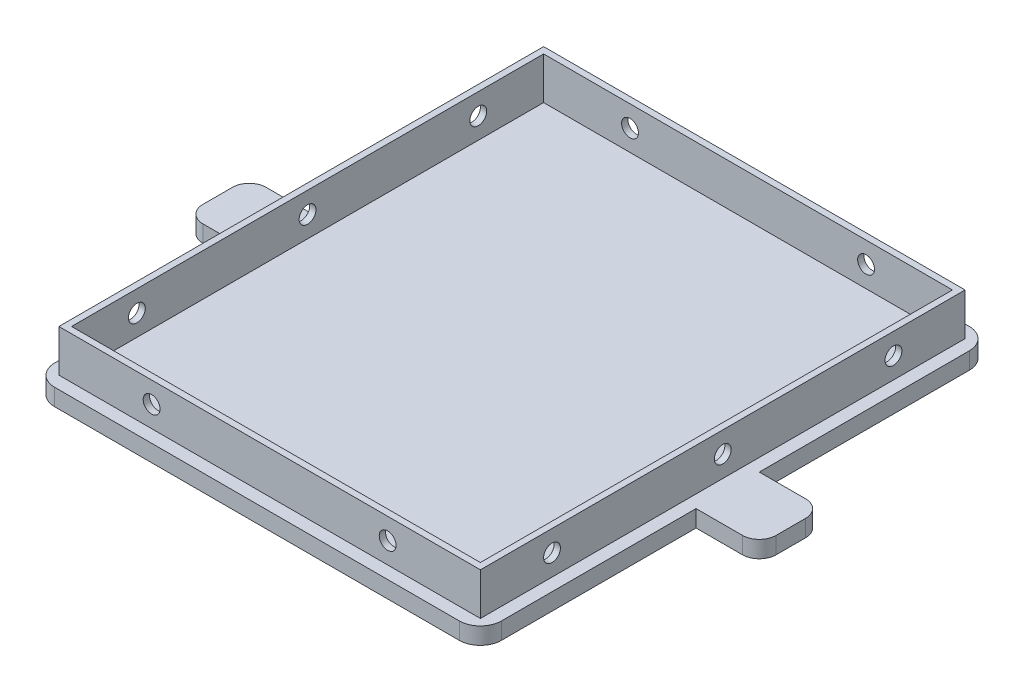
from build123d import *

# Parameters (mm, degrees)
SKETCH1_W           = 106
SKETCH1_H           = 121
BOSS_EXTRUDE1_DEPTH = 4
SKETCH2_W           = 100
SKETCH2_H           = 115
SKETCH2_W_2         = 97
SKETCH2_H_2         = 112
BOSS_EXTRUDE2_DEPTH = 10
SKETCH5_W           = 15
SKETCH5_H           = 15
BOSS_EXTRUDE4_DEPTH = 4
FILLET1_R           = 4
SKETCH6_R           = 2
CUT_EXTRUDE1_DEPTH  = 119
SKETCH7_R           = 2
CUT_EXTRUDE2_DEPTH  = 126
FILLET2_R           = 5


with BuildPart() as part:
    # Sketch1 → Boss-Extrude1 (new body)
    with BuildSketch(Plane(origin=(0, 0, 0), x_dir=(1, 0, 0), z_dir=(0, 1, 0))):
        Rectangle(SKETCH1_W, SKETCH1_H)
    extrude(amount=BOSS_EXTRUDE1_DEPTH)

    # Sketch2 → Boss-Extrude2 (add)
    with BuildSketch(Plane(origin=(0, 4, 0), x_dir=(1, 0, 0), z_dir=(0, 1, 0))):
        Rectangle(SKETCH2_W, SKETCH2_H)
        Rectangle(SKETCH2_W_2, SKETCH2_H_2, mode=Mode.SUBTRACT)
    extrude(amount=BOSS_EXTRUDE2_DEPTH)

    # Sketch5 → Boss-Extrude4 (add)
    with BuildSketch(Plane.XZ):
        with Locations((60.5, 1.833292933)):
            Rectangle(SKETCH5_W, SKETCH5_H)
        with Locations((-60.5, 1.833292933)):
            Rectangle(SKETCH5_W, SKETCH5_H)
    extrude(amount=-BOSS_EXTRUDE4_DEPTH)

    # Fillet1
    fillet1_edges = [part.edges().sort_by_distance(p)[0] for p in [
        (68, 2, -5.666707067),
        (68, 2, 9.333292933),
        (-68, 2, 9.333292933),
        (-68, 2, -5.666707067),
    ]]
    fillet(fillet1_edges, radius=FILLET1_R)

    # Sketch6 → Cut-Extrude1 (cut)
    with BuildSketch(Plane(origin=(53, 0, 0), x_dir=(0, 0, -1), z_dir=(1, 0, 0))):
        with Locations((40.5, 9)):
            Circle(SKETCH6_R)
        with Locations((0, 9)):
            Circle(SKETCH6_R)
        with Locations((-40.5, 9)):
            Circle(SKETCH6_R)
    extrude(amount=-CUT_EXTRUDE1_DEPTH, mode=Mode.SUBTRACT)

    # Sketch7 → Cut-Extrude2 (cut)
    with BuildSketch(Plane.XY.offset(60.5)):
        with Locations(Location((28, 9, 0), (0, 0, 180))):
            Circle(SKETCH7_R)
        with Locations(Location((-28, 9, 0), (0, 0, 180))):
            Circle(SKETCH7_R)
    extrude(amount=-CUT_EXTRUDE2_DEPTH, mode=Mode.SUBTRACT)

    # Fillet2
    fillet2_edges = [part.edges().sort_by_distance(p)[0] for p in [
        (53, 2, 60.5),
        (-53, 2, 60.5),
        (-53, 2, -60.5),
        (53, 2, -60.5),
    ]]
    fillet(fillet2_edges, radius=FILLET2_R)


solid = part.part
